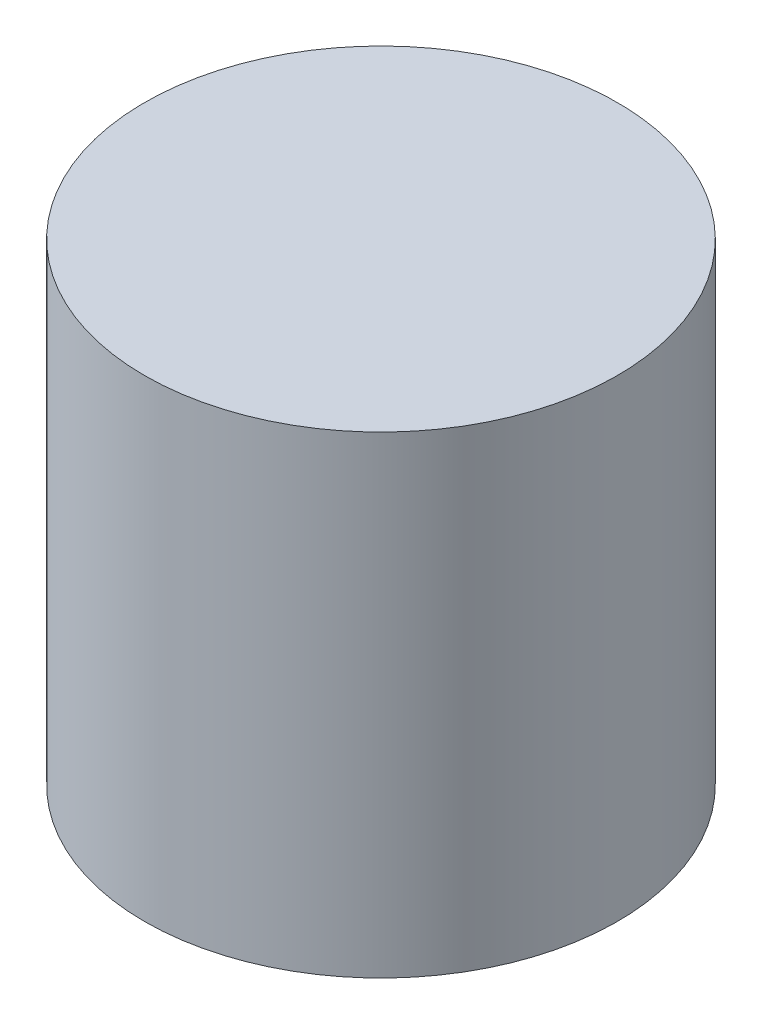
from build123d import *

# Parameters (mm, degrees)
SKETCH1_R           = 25.4
BOSS_EXTRUDE1_DEPTH = 50.8


with BuildPart() as part:
    # Sketch1 → Boss-Extrude1 (new body)
    with BuildSketch(Plane(origin=(0, 0, 0), x_dir=(1, 0, 0), z_dir=(0, 1, 0))):
        with Locations(Location((0, 0, 0), (0, 0, 270))):
            Circle(SKETCH1_R)
    extrude(amount=BOSS_EXTRUDE1_DEPTH)


solid = part.part
